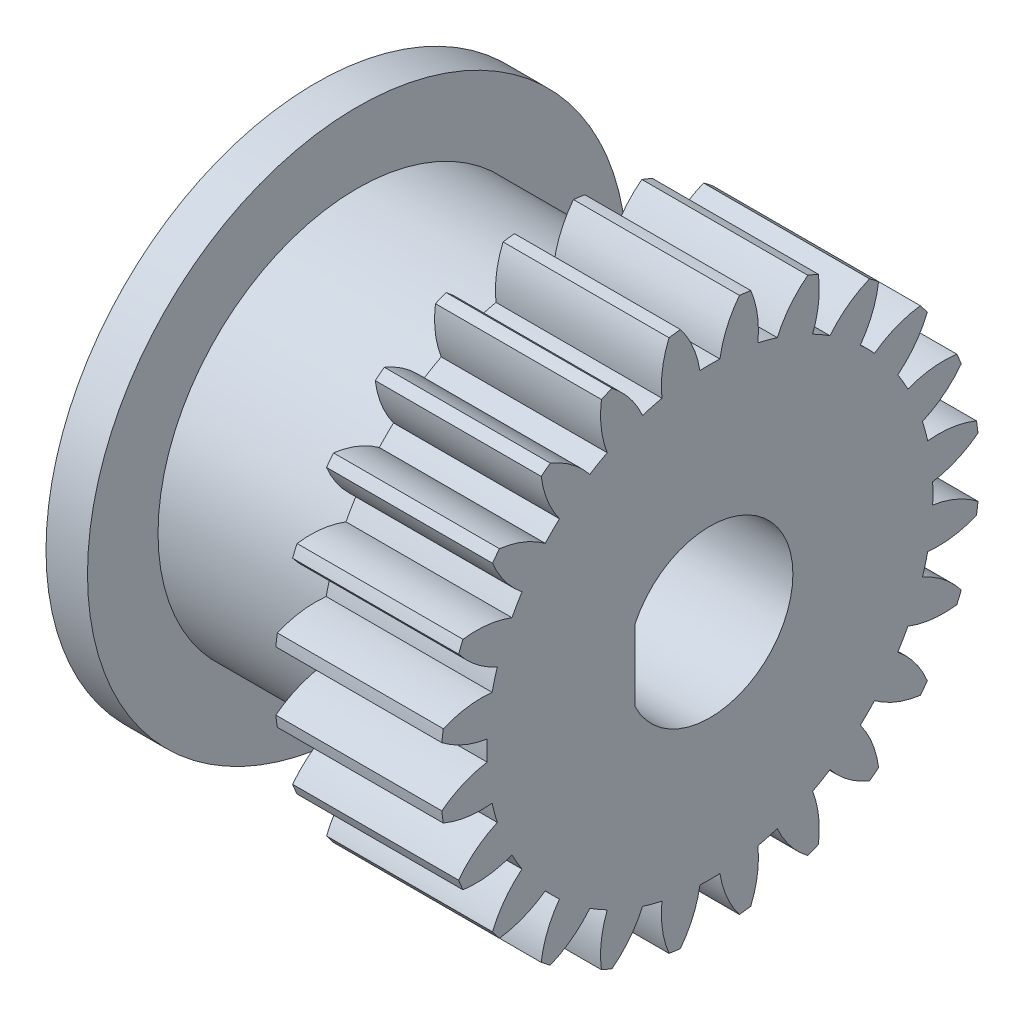
from build123d import *

# Parameters (mm, degrees)
BASPROSKE_W         = 4
BASPROSKE_H         = 6.5
TOOTHCUT_DEPTH      = 11.024968828
TEETHCUTS_COUNT     = 24
TEETHCUTS_ANGLE     = 345
BORSKE_R            = 1.5
BORE_DEPTH          = 50.0000508
SKETCH_1_R          = 4.8
SKETCH_1_R_2        = 1.5
EXTRUDE_1_DEPTH     = 4.5
SKETCH_2_R          = 6.5
SKETCH_2_R_2        = 1.5
EXTRUDE_2_DEPTH     = 1
CUT_EXTRUDE_1_REACH = 15.219


with BuildPart() as part:
    # BasProSke → Base-Revolve (revolve)
    with BuildSketch(Plane(origin=(0, 0, 0), x_dir=(1, 0, 0), z_dir=(0, 1, 0)), mode=Mode.PRIVATE) as base_revolve_sk:
        with Locations((2, 3.25)):
            Rectangle(BASPROSKE_W, BASPROSKE_H)
    revolve(base_revolve_sk.sketch.rotate(Axis((-10, 0, 0), (1, 0, 0)), 180), axis=Axis((-10, 0, 0), (1, 0, 0)))

    # TooCutSke → ToothCut (cut, through all)
    with BuildSketch(Plane(origin=(0, 0, 0), x_dir=(0, 0, -1), z_dir=(1, 0, 0))):
        with BuildLine():
            ThreePointArc((0.241646108, 5.368564348), (0, 5.374), (-0.241646108, 5.368564348))
            ThreePointArc((-0.241646108, 5.368564348), (-0.413699957, 5.957993365), (-0.729686037, 6.48447403))
            ThreePointArc((-0.729686037, 6.48447403), (0, 6.5254), (0.729686037, 6.48447403))
            ThreePointArc((0.729686037, 6.48447403), (0.413699957, 5.957993365), (0.241646108, 5.368564348))
        make_face()
    toothcut = extrude(amount=TOOTHCUT_DEPTH, mode=Mode.SUBTRACT)

    # TeethCuts: ToothCut ×24 about axis
    teethcuts_axis = Axis((-10, 0, 0), (1, 0, 0))
    for i in range(1, TEETHCUTS_COUNT):
        add(toothcut.rotate(teethcuts_axis, i * TEETHCUTS_ANGLE / (TEETHCUTS_COUNT - 1)), mode=Mode.SUBTRACT)

    # BorSke → Bore (cut, symmetric)
    with BuildSketch(Plane(origin=(0, 0, 0), x_dir=(0, 0, -1), z_dir=(1, 0, 0))):
        with Locations(Location((0, 0, 0), (0, 0, 180))):
            Circle(BORSKE_R)
    extrude(amount=BORE_DEPTH, both=True, mode=Mode.SUBTRACT)

    # 草图1 → 凸台-拉伸1 (add)
    with BuildSketch(Plane.ZY):
        with Locations(Location((0, 0, 0), (0, 0, 180))):
            Circle(SKETCH_1_R)
        Circle(SKETCH_1_R_2, mode=Mode.SUBTRACT)
    extrude(amount=EXTRUDE_1_DEPTH)

    # 草图2 → 凸台-拉伸2 (add)
    with BuildSketch(Plane.ZY.offset(4.5)):
        Circle(SKETCH_2_R)
        Circle(SKETCH_2_R_2, mode=Mode.SUBTRACT)
    extrude(amount=EXTRUDE_2_DEPTH)

    # 草图3 → 切除-拉伸1 (cut, up to next)
    with BuildSketch(Plane.ZY.offset(5.5), mode=Mode.PRIVATE) as cut_extrude_1_sk1:
        with BuildLine():
            Line((1.8, -0.871779789), (1.8, 0.871779789))
            ThreePointArc((1.8, 0.871779789), (-2, 0), (1.8, -0.871779789))
        make_face()
    cut_extrude_1_tool1 = extrude(cut_extrude_1_sk1.sketch, amount=-CUT_EXTRUDE_1_REACH, mode=Mode.PRIVATE) & part.part
    add(cut_extrude_1_tool1.solids().sort_by_distance((-5.5, 0, -0.035819))[0], mode=Mode.SUBTRACT)


solid = part.part
